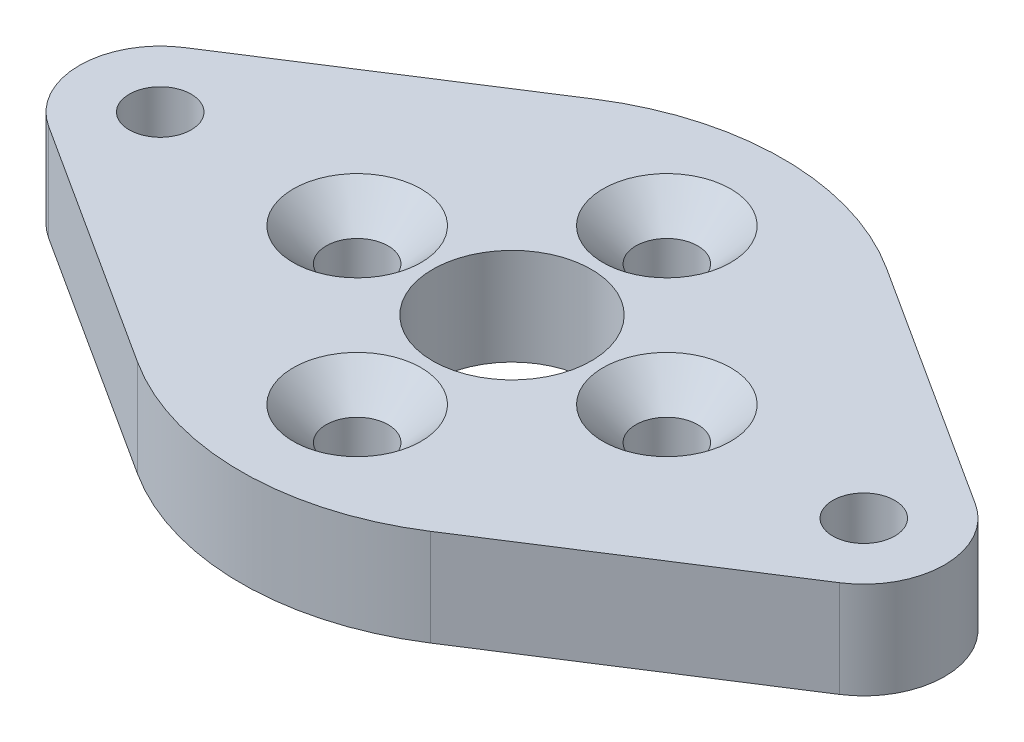
from build123d import *

# Parameters (mm, degrees)
SKETCH1_R           = 4.1
SKETCH1_R_2         = 1.6
BOSS_EXTRUDE1_DEPTH = 5
CHAMFER1_SIZE       = 1.7
CHAMFER2_SIZE       = 1.7


with BuildPart() as part:
    # Sketch1 → Boss-Extrude1 (new body)
    with BuildSketch(Plane(origin=(0, 0, 0), x_dir=(1, 0, 0), z_dir=(0, 1, 0))):
        with BuildLine():
            Line((-20.432418055, 3.512858569), (-7.567581945, 11.778442321))
            ThreePointArc((-7.567581945, 11.778442321), (0, 14), (7.567581945, 11.778442321))
            Line((7.567581945, 11.778442321), (20.432418055, 3.512858569))
            ThreePointArc((20.432418055, 3.512858569), (22.350852961, 0), (20.432418055, -3.512858569))
            Line((20.432418055, -3.512858569), (7.567581945, -11.778442321))
            ThreePointArc((7.567581945, -11.778442321), (0, -14), (-7.567581945, -11.778442321))
            Line((-7.567581945, -11.778442321), (-20.432418055, -3.512858569))
            ThreePointArc((-20.432418055, -3.512858569), (-22.350852961, 0), (-20.432418055, 3.512858569))
        make_face()
        with Locations(Location((0, 0, 0), (0, 0, 270))):
            Circle(SKETCH1_R, mode=Mode.SUBTRACT)
        with Locations(Location((-18.175426481, 0, 0), (0, 0, 270))):
            Circle(SKETCH1_R_2, mode=Mode.SUBTRACT)
        with Locations(Location((18.175426481, 0, 0), (0, 0, 270))):
            Circle(SKETCH1_R_2, mode=Mode.SUBTRACT)
        with Locations(Location((8, 0, 0), (0, 0, 270))):
            Circle(SKETCH1_R_2, mode=Mode.SUBTRACT)
        with Locations(Location((0, 8, 0), (0, 0, 270))):
            Circle(SKETCH1_R_2, mode=Mode.SUBTRACT)
        with Locations(Location((-8, 0, 0), (0, 0, 270))):
            Circle(SKETCH1_R_2, mode=Mode.SUBTRACT)
        with Locations(Location((0, -8, 0), (0, 0, 270))):
            Circle(SKETCH1_R_2, mode=Mode.SUBTRACT)
    extrude(amount=BOSS_EXTRUDE1_DEPTH)

    # Chamfer1
    chamfer1_edges = [part.edges().sort_by_distance(p)[0] for p in [
        (0, 5, -9.6),
        (8, 5, -1.6),
        (-8, 5, -1.6),
        (0, 5, 6.4),
    ]]
    chamfer(chamfer1_edges, length=CHAMFER1_SIZE)

    # Chamfer2
    chamfer2_edges = [part.edges().sort_by_distance(p)[0] for p in [
        (-18.175426481, 0, -1.6),
        (18.175426481, 0, -1.6),
    ]]
    chamfer(chamfer2_edges, length=CHAMFER2_SIZE)


solid = part.part
